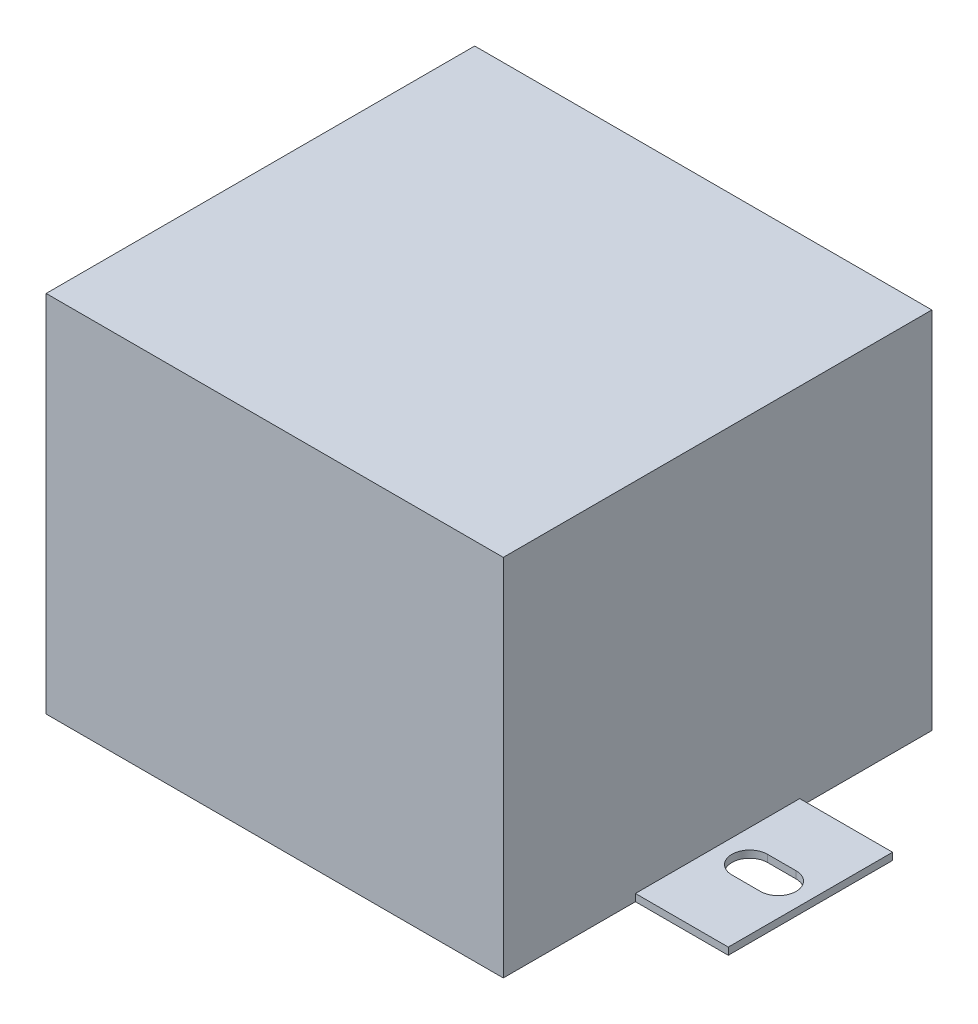
from build123d import *

# Parameters (mm, degrees)
SALIENTE_EXTRUIR1_DEPTH = 1
CROQUIS2_W              = 64
CROQUIS2_H              = 60
SALIENTE_EXTRUIR2_DEPTH = 50


with BuildPart() as part:
    # Croquis1 → Saliente-Extruir1 (new body)
    with BuildSketch(Plane(origin=(0, 0, 0), x_dir=(1, 0, 0), z_dir=(0, 1, 0))):
        Polygon((-32, 11.5), (-45, 11.5), (-45, -11.5), (-32, -11.5), (-32, -30), (32, -30), (32, -11.5), (45, -11.5), (45, 11.5), (32, 11.5), (32, 30), (-32, 30), align=None)
        with BuildLine():
            Line((-40.5, -2.5), (-36.5, -2.5))
            ThreePointArc((-36.5, -2.5), (-34, 0), (-36.5, 2.5))
            Line((-36.5, 2.5), (-40.5, 2.5))
            ThreePointArc((-40.5, 2.5), (-43, 0), (-40.5, -2.5))
        make_face(mode=Mode.SUBTRACT)
        with BuildLine():
            Line((40.5, -2.5), (36.5, -2.5))
            ThreePointArc((36.5, -2.5), (34, 0), (36.5, 2.5))
            Line((36.5, 2.5), (40.5, 2.5))
            ThreePointArc((40.5, 2.5), (43, 0), (40.5, -2.5))
        make_face(mode=Mode.SUBTRACT)
    extrude(amount=SALIENTE_EXTRUIR1_DEPTH)

    # Croquis2 → Saliente-Extruir2 (add)
    with BuildSketch(Plane(origin=(0, 1, 0), x_dir=(1, 0, 0), z_dir=(0, 1, 0))):
        Rectangle(CROQUIS2_W, CROQUIS2_H)
    extrude(amount=SALIENTE_EXTRUIR2_DEPTH)


solid = part.part
